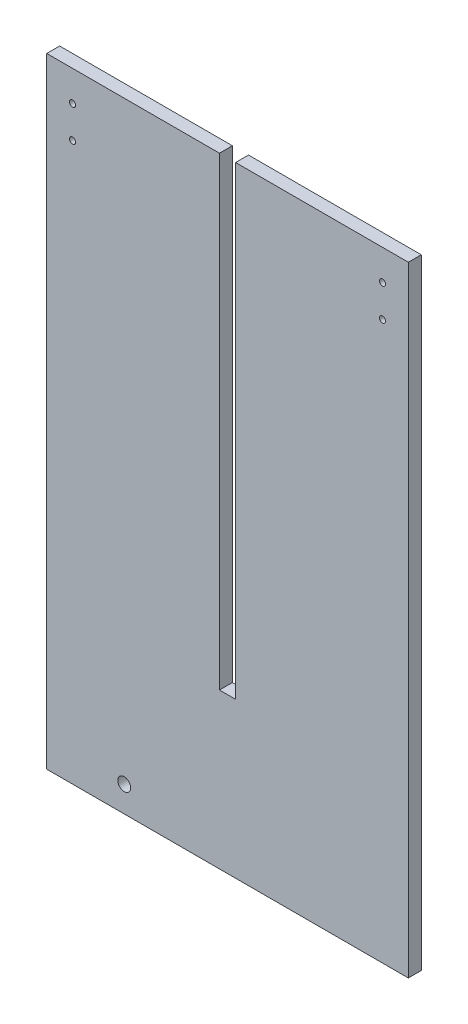
from build123d import *

# Parameters (mm, degrees)
SKETCH2_W           = 6.35
SKETCH2_H           = 44.45
SKETCH2_W_2         = 20.864285714
SKETCH2_H_2         = 6.35
SKETCH2_W_3         = 27.214285714
BOSS_EXTRUDE1_DEPTH = 6.35
SKETCH3_W           = 7.9375
SKETCH3_H           = 228.6
CUT_EXTRUDE1_DEPTH  = 186.241592252
SKETCH4_R           = 3.175
CUT_EXTRUDE2_DEPTH  = 186.241592252
SKETCH5_R           = 1.5
CUT_EXTRUDE3_DEPTH  = 6.35
SKETCH6_W           = 6.35
SKETCH6_H           = 44.45
BOSS_EXTRUDE2_DEPTH = 6.35
SKETCH7_W           = 27.214285714
SKETCH7_H           = 6.35
CUT_EXTRUDE4_DEPTH  = 6.35
SKETCH9_W           = 6.35
SKETCH9_H           = 222.25
SKETCH9_W_2         = 20.864285714
SKETCH9_H_2         = 6.35
CUT_EXTRUDE5_DEPTH  = 6.35


with BuildPart() as part:
    # Sketch2 → Boss-Extrude1 (new body)
    with BuildSketch(Plane.XY):
        Polygon((0, -152.4), (0, 152.4), (-88.9, 152.4), (-88.9, 107.95), (-88.9, 63.5), (-88.9, 19.05), (-88.9, -25.4), (-88.9, -69.85), (-88.9, -114.3), (-88.9, -152.4), (-68.035714286, -152.4), (-40.821428571, -152.4), (-13.607142857, -152.4), align=None)
        Polygon((88.9, 152.4), (0, 152.4), (0, -152.4), (13.607142857, -152.4), (40.821428571, -152.4), (68.035714286, -152.4), (88.9, -152.4), (88.9, -114.3), (88.9, -69.85), (88.9, -25.4), (88.9, 19.05), (88.9, 63.5), (88.9, 107.95), align=None)
        with Locations((-92.075, 85.725)):
            Rectangle(SKETCH2_W, SKETCH2_H)
        with Locations((-92.075, -3.175)):
            Rectangle(SKETCH2_W, SKETCH2_H)
        with Locations((-92.075, -92.075)):
            Rectangle(SKETCH2_W, SKETCH2_H)
        with Locations((-78.467857143, -155.575)):
            Rectangle(SKETCH2_W_2, SKETCH2_H_2)
        with Locations((-27.214285714, -155.575)):
            Rectangle(SKETCH2_W_3, SKETCH2_H_2)
        with Locations((27.214285714, -155.575)):
            Rectangle(SKETCH2_W_3, SKETCH2_H_2)
        with Locations((92.075, -92.075)):
            Rectangle(SKETCH2_W, SKETCH2_H)
        with Locations((92.075, -3.175)):
            Rectangle(SKETCH2_W, SKETCH2_H)
        with Locations((92.075, 85.725)):
            Rectangle(SKETCH2_W, SKETCH2_H)
        with Locations((78.467857143, -155.575)):
            Rectangle(SKETCH2_W_2, SKETCH2_H_2)
    extrude(amount=BOSS_EXTRUDE1_DEPTH)

    # Sketch3 → Cut-Extrude1 (cut, through all)
    with BuildSketch(Plane.XY.offset(6.35)):
        with Locations((0, 38.1)):
            Rectangle(SKETCH3_W, SKETCH3_H)
    extrude(amount=-CUT_EXTRUDE1_DEPTH, mode=Mode.SUBTRACT)

    # Sketch4 → Cut-Extrude2 (cut, through all)
    with BuildSketch(Plane.XY.offset(6.35)):
        with Locations((-50.8, -139.7)):
            Circle(SKETCH4_R)
    extrude(amount=-CUT_EXTRUDE2_DEPTH, mode=Mode.SUBTRACT)

    # Sketch5 → Cut-Extrude3 (cut)
    with BuildSketch(Plane.XY.offset(6.35)):
        with Locations((-76.2, 137.4)):
            Circle(SKETCH5_R)
        with Locations((-76.2, 121.65)):
            Circle(SKETCH5_R)
        with Locations((76.2, 121.65)):
            Circle(SKETCH5_R)
        with Locations((76.2, 137.4)):
            Circle(SKETCH5_R)
    extrude(amount=-CUT_EXTRUDE3_DEPTH, mode=Mode.SUBTRACT)

    # Sketch6 → Boss-Extrude2 (add)
    with BuildSketch(Plane.XY.offset(6.35)):
        with Locations((-92.075, 41.275)):
            Rectangle(SKETCH6_W, SKETCH6_H)
        with Locations((-92.075, -47.625)):
            Rectangle(SKETCH6_W, SKETCH6_H)
        with Locations((92.075, 41.275)):
            Rectangle(SKETCH6_W, SKETCH6_H)
        with Locations((92.075, -47.625)):
            Rectangle(SKETCH6_W, SKETCH6_H)
    extrude(amount=-BOSS_EXTRUDE2_DEPTH)

    # Sketch7 → Cut-Extrude4 (cut)
    with BuildSketch(Plane.XY.offset(6.35)):
        with Locations((-27.214285714, -155.575)):
            Rectangle(SKETCH7_W, SKETCH7_H)
        with Locations((27.214285714, -155.575)):
            Rectangle(SKETCH7_W, SKETCH7_H)
    extrude(amount=-CUT_EXTRUDE4_DEPTH, mode=Mode.SUBTRACT)

    # Sketch9 → Cut-Extrude5 (cut)
    with BuildSketch(Plane(origin=(0, 0, 0), x_dir=(-1, 0, 0), z_dir=(0, 0, -1))):
        with Locations((-92.075, -3.175)):
            Rectangle(SKETCH9_W, SKETCH9_H)
        with Locations((92.075, -3.175)):
            Rectangle(SKETCH9_W, SKETCH9_H)
        with Locations((-78.467857143, -155.575)):
            Rectangle(SKETCH9_W_2, SKETCH9_H_2)
        with Locations((78.467857143, -155.575)):
            Rectangle(SKETCH9_W_2, SKETCH9_H_2)
    extrude(amount=-CUT_EXTRUDE5_DEPTH, mode=Mode.SUBTRACT)


solid = part.part
